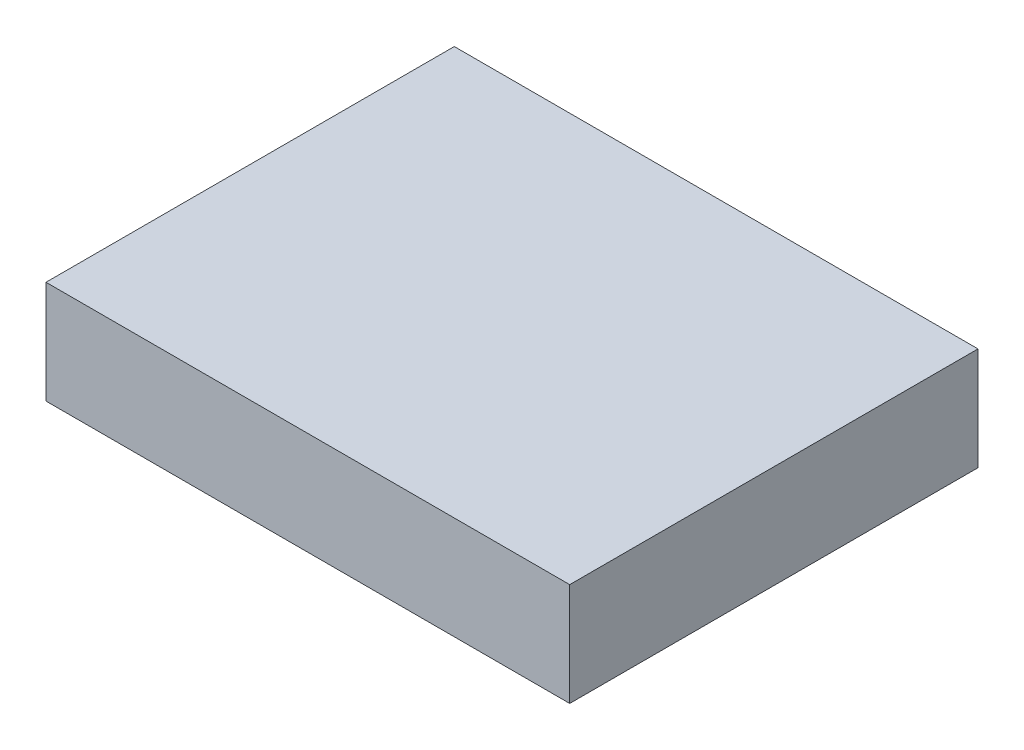
from build123d import *

# Parameters (mm, degrees)
SKETCH1_W           = 50.884502354
SKETCH1_H           = 39.669825848
BOSS_EXTRUDE1_DEPTH = 10


with BuildPart() as part:
    # Sketch1 → Boss-Extrude1 (new body)
    with BuildSketch(Plane(origin=(0, 0, 0), x_dir=(1, 0, 0), z_dir=(0, 1, 0))):
        Rectangle(SKETCH1_W, SKETCH1_H)
    extrude(amount=BOSS_EXTRUDE1_DEPTH)


solid = part.part
